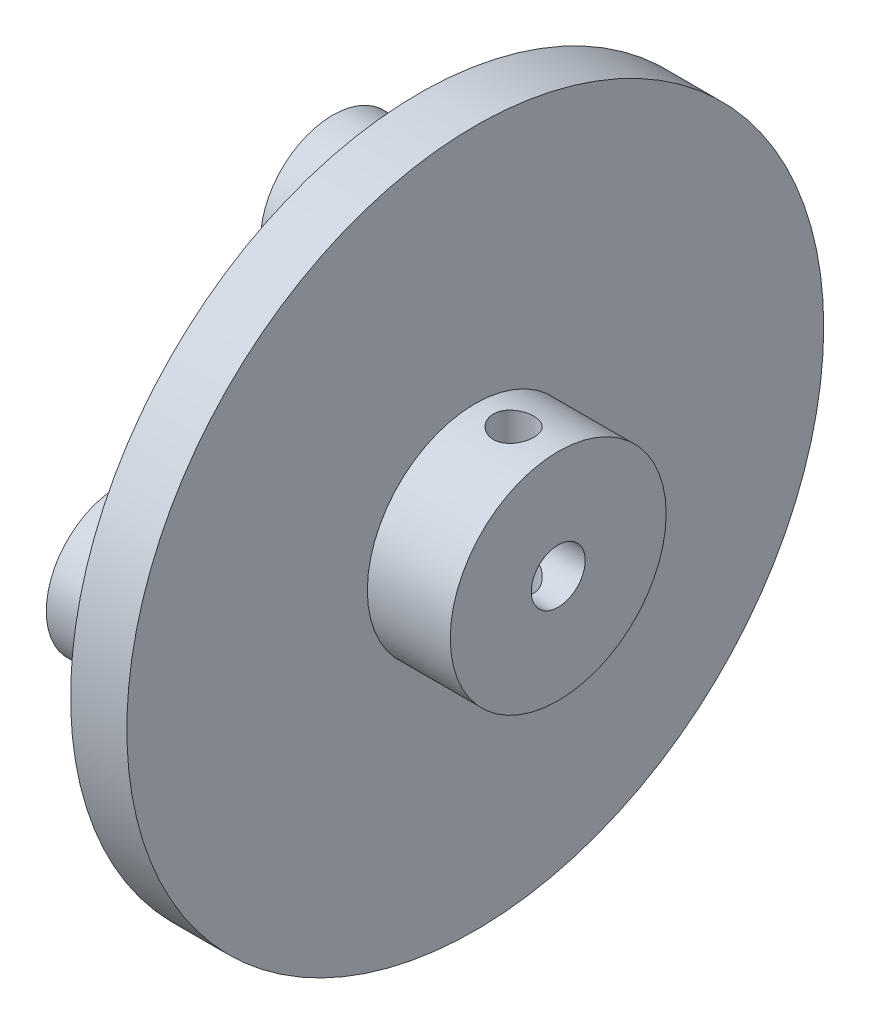
from build123d import *

# Parameters (mm, degrees)
SKETCH2_R               = 4.25
BOSS_EXTRUDE1_DEPTH     = 5.08
CUT_EXTRUDE1_DEPTH      = 32.882966676
CUT_EXTRUDE1_DEPTH_BACK = 32.882966676
SKETCH3_R               = 1.190625


with BuildPart() as part:
    # Sketch1 → Revolve1 (revolve)
    with BuildSketch(Plane.XY):
        Polygon((0, 1.5875), (0, 6.35), (-4.87911158, 6.35), (-4.87911158, 20.5), (-8.187387237, 20.5), (-8.187387237, 4.5), (-6.426815736, 4.5), (-6.426815736, 1.5875), align=None)
    revolve(axis=Axis((0, 0, 0), (-1, 0, 0)))

    # Sketch2 → Boss-Extrude1 (add)
    with BuildSketch(Plane.ZY.offset(8.187387237)):
        with Locations((0, 12.6)):
            Circle(SKETCH2_R)
        with Locations((12.6, 0)):
            Circle(SKETCH2_R)
        with Locations((0, -12.6)):
            Circle(SKETCH2_R)
        with Locations((-12.6, 0)):
            Circle(SKETCH2_R)
    extrude(amount=BOSS_EXTRUDE1_DEPTH)

    # Sketch3 → Cut-Extrude1 (cut, two sides: drawn at the far end of the back side and taken through both)
    with BuildSketch(Plane(origin=(0, 0, 0), x_dir=(1, 0, 0), z_dir=(0, 1, 0)).offset(-CUT_EXTRUDE1_DEPTH_BACK)):
        with Locations((-2.623694819, 0)):
            Circle(SKETCH3_R)
    extrude(amount=CUT_EXTRUDE1_DEPTH + CUT_EXTRUDE1_DEPTH_BACK, mode=Mode.SUBTRACT)


solid = part.part
